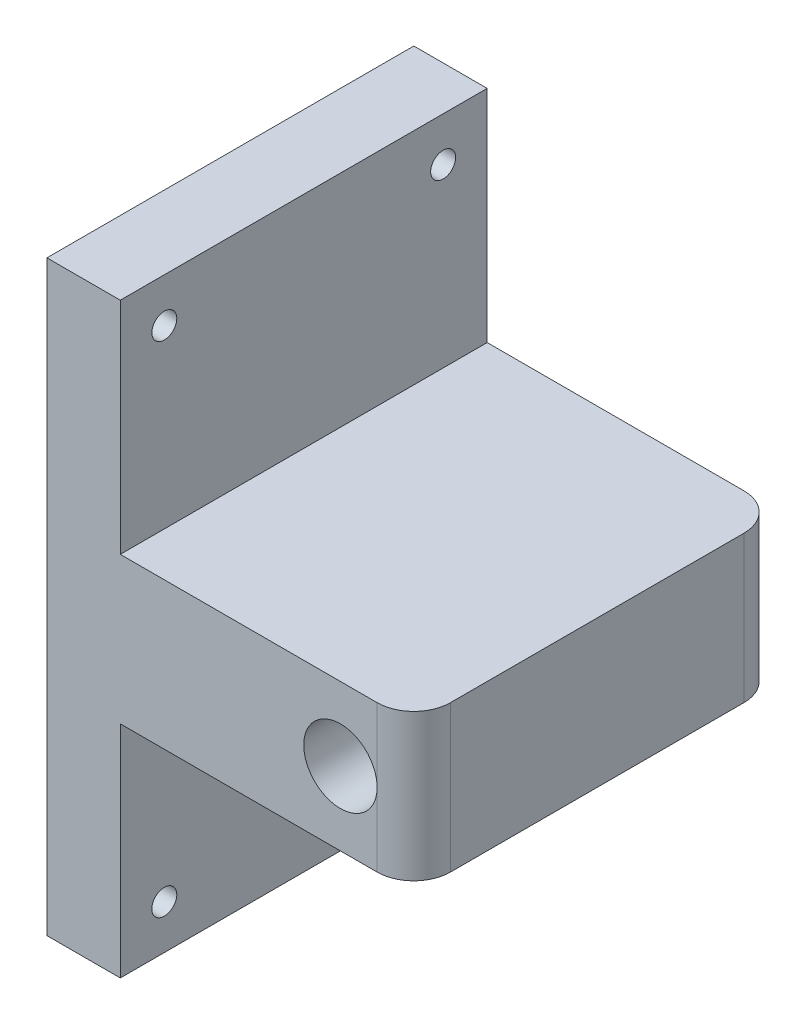
from build123d import *

# Parameters (mm, degrees)
SKETCH1_W                      = 50
SKETCH1_H                      = 50
BOSS_EXTRUDE1_DEPTH            = 20
FILLET1_R                      = 5
CUT_EXTRUDE1_REACH             = 75.485
SKETCH2_R                      = 5
BOSS_EXTRUDE2_DEPTH            = 40
BOSS_EXTRUDE2_DEPTH_BACK       = 40
SKETCH3_W                      = 10
SKETCH3_H                      = 50
M3_CLEARANCE_HOLE1_D           = 3.4
M3_CLEARANCE_HOLE1_CSINK_D     = 3.45
M3_CLEARANCE_HOLE1_CSINK_ANGLE = 90


with BuildPart() as part:
    # Sketch1 → Boss-Extrude1 (new body)
    with BuildSketch(Plane(origin=(0, 0, 0), x_dir=(1, 0, 0), z_dir=(0, 1, 0))):
        with Locations((25, 0)):
            Rectangle(SKETCH1_W, SKETCH1_H)
    extrude(amount=BOSS_EXTRUDE1_DEPTH)

    # Fillet1
    fillet1_edges = [part.edges().sort_by_distance(p)[0] for p in [
        (50, 10, -25),
        (50, 10, 25),
    ]]
    fillet(fillet1_edges, radius=FILLET1_R)

    # Sketch2 → Cut-Extrude1 (cut, up to next)
    with BuildSketch(Plane.XY.offset(25), mode=Mode.PRIVATE) as cut_extrude1_sk1:
        with Locations((40, 10)):
            Circle(SKETCH2_R)
    cut_extrude1_tool1 = extrude(cut_extrude1_sk1.sketch, amount=-CUT_EXTRUDE1_REACH, mode=Mode.PRIVATE) & part.part
    add(cut_extrude1_tool1.solids().sort_by_distance((40, 10, 25))[0], mode=Mode.SUBTRACT)

    # Sketch3 → Boss-Extrude2 (add, two sides: drawn at the far end of the back side and taken through both)
    with BuildSketch(Plane(origin=(0, 10, 0), x_dir=(1, 0, 0), z_dir=(0, 1, 0)).offset(-BOSS_EXTRUDE2_DEPTH_BACK)):
        with Locations((5, 0)):
            Rectangle(SKETCH3_W, SKETCH3_H)
    extrude(amount=BOSS_EXTRUDE2_DEPTH + BOSS_EXTRUDE2_DEPTH_BACK)

    # M3 Clearance Hole1 (through all)
    with Locations(Plane.ZY):
        with Locations((-19, 44), (19, 44), (-19, -24), (19, -24)):
            CounterSinkHole(M3_CLEARANCE_HOLE1_D / 2, M3_CLEARANCE_HOLE1_CSINK_D / 2, counter_sink_angle=M3_CLEARANCE_HOLE1_CSINK_ANGLE)


solid = part.part
